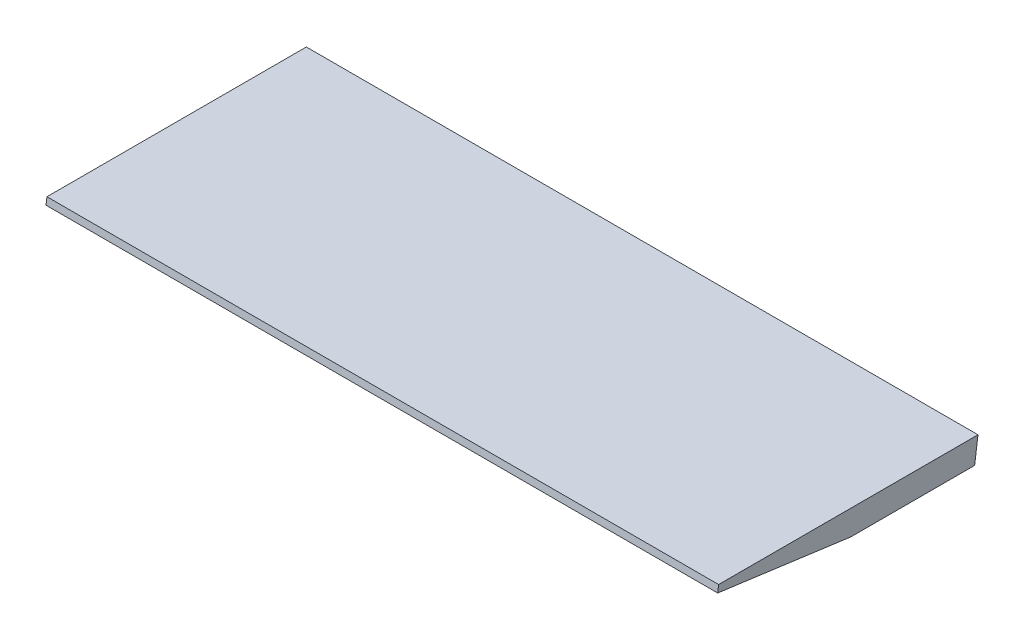
from build123d import *

# Parameters (mm, degrees)
SKETCH1_W           = 514.35
SKETCH1_H           = 203.2
BOSS_EXTRUDE1_DEPTH = 19.05
CUT_EXTRUDE3_DEPTH  = 781.686405159


with BuildPart() as part:
    # Sketch1 → Boss-Extrude1 (new body)
    with BuildSketch(Plane(origin=(0, 0, 0), x_dir=(1, 0, 0), z_dir=(0, 1, 0))):
        with Locations((257.175, 101.6)):
            Rectangle(SKETCH1_W, SKETCH1_H)
    extrude(amount=BOSS_EXTRUDE1_DEPTH)

    # Sketch5 → Cut-Extrude3 (cut)
    with BuildSketch(Plane(origin=(514.35, 0, 0), x_dir=(0, 0, -1), z_dir=(1, 0, 0))):
        Polygon((0, 19.05), (4.561624762, 19.05), (3.848243249, 13.769669769), (105.769027955, 0), (0, 0), align=None)
        Polygon((203.2, 19.05), (200.626312897, 0), (203.2, 0), align=None)
    extrude(amount=-CUT_EXTRUDE3_DEPTH, mode=Mode.SUBTRACT)


solid = part.part
